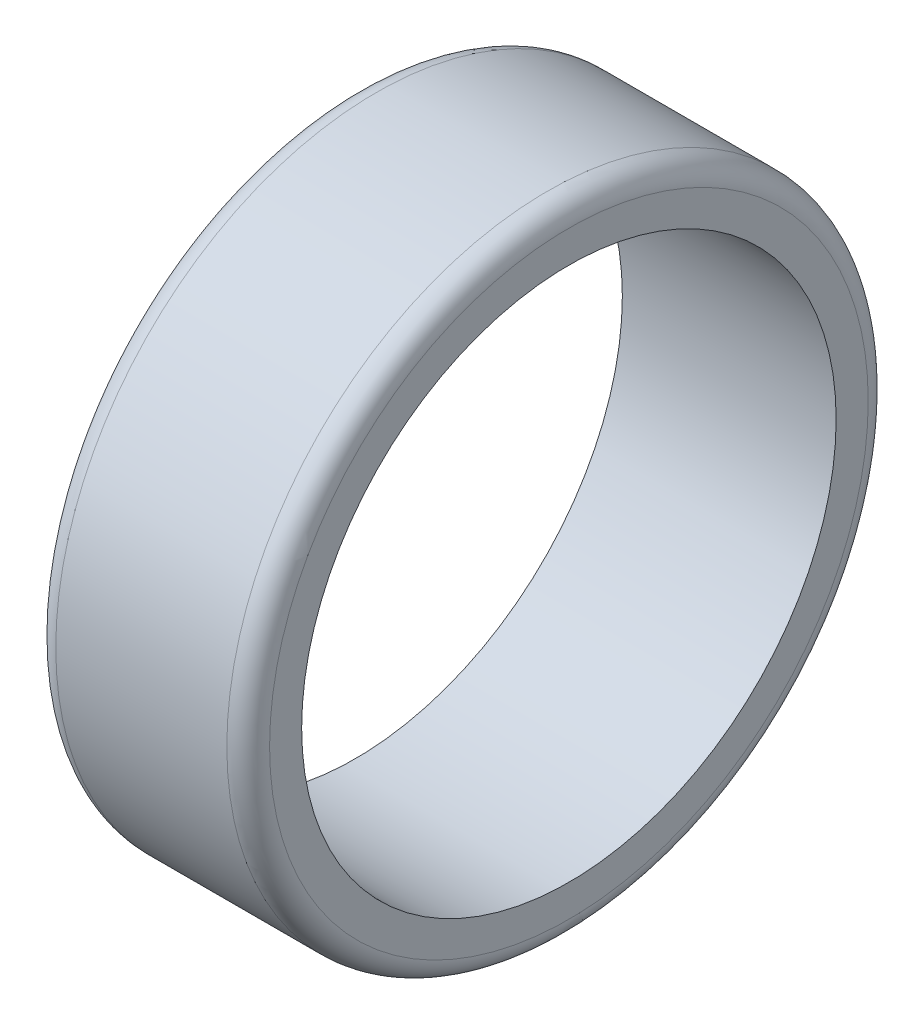
from build123d import *

# Parameters (mm, degrees)
SKETCH1_W = 10
SKETCH1_H = 2.5
FILLET1_R = 1


with BuildPart() as part:
    # Sketch1 → Revolve1 (revolve)
    with BuildSketch(Plane.XY, mode=Mode.PRIVATE) as revolve1_sk:
        with Locations((8, 13.75)):
            Rectangle(SKETCH1_W, SKETCH1_H)
    revolve(revolve1_sk.sketch.rotate(Axis((0, 0, 0), (1, 0, 0)), 90), axis=Axis((0, 0, 0), (1, 0, 0)))

    # Fillet1
    fillet1_edges = [part.edges().sort_by_distance(p)[0] for p in [
        (3, 0, -15),
        (13, 0, -15),
    ]]
    fillet(fillet1_edges, radius=FILLET1_R)


solid = part.part
